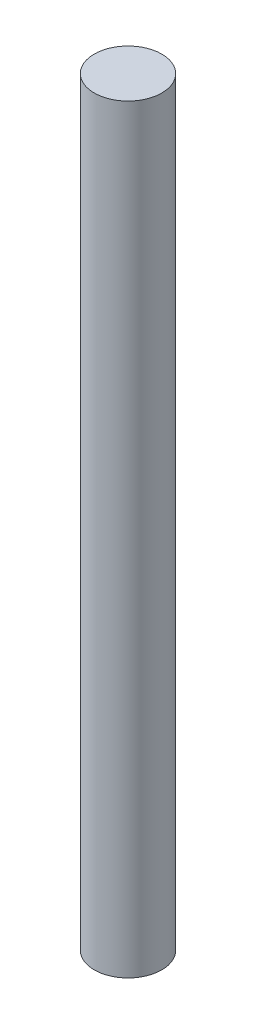
from build123d import *

# Parameters (mm, degrees)
SKETCH_1_R      = 2
EXTRUDE_1_DEPTH = 45


with BuildPart() as part:
    # 草图1 → 凸台-拉伸1 (new body)
    with BuildSketch(Plane(origin=(0, 0, 0), x_dir=(1, 0, 0), z_dir=(0, 1, 0))):
        with Locations(Location((0, 0, 0), (0, 0, 90))):
            Circle(SKETCH_1_R)
    extrude(amount=EXTRUDE_1_DEPTH)


solid = part.part
